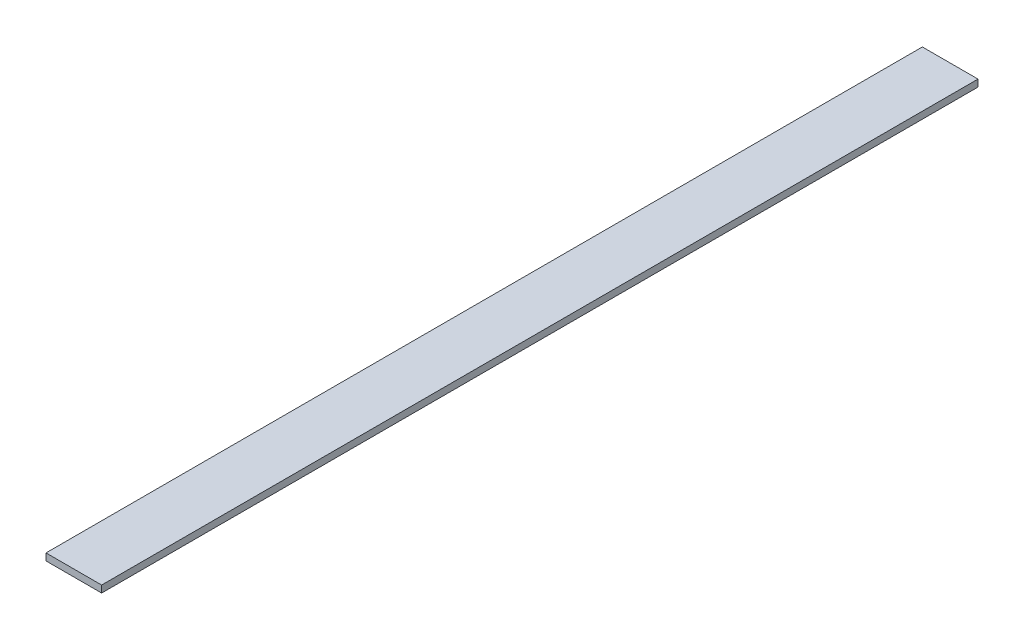
from build123d import *

# Parameters (mm, degrees)
SKETCH2_W           = 50.8
SKETCH2_H           = 6.35
BOSS_EXTRUDE1_DEPTH = 800


with BuildPart() as part:
    # Sketch2 → Boss-Extrude1 (new body)
    with BuildSketch(Plane.XY):
        with Locations((18.243911917, 0.098704663)):
            Rectangle(SKETCH2_W, SKETCH2_H)
    extrude(amount=-BOSS_EXTRUDE1_DEPTH)


solid = part.part
